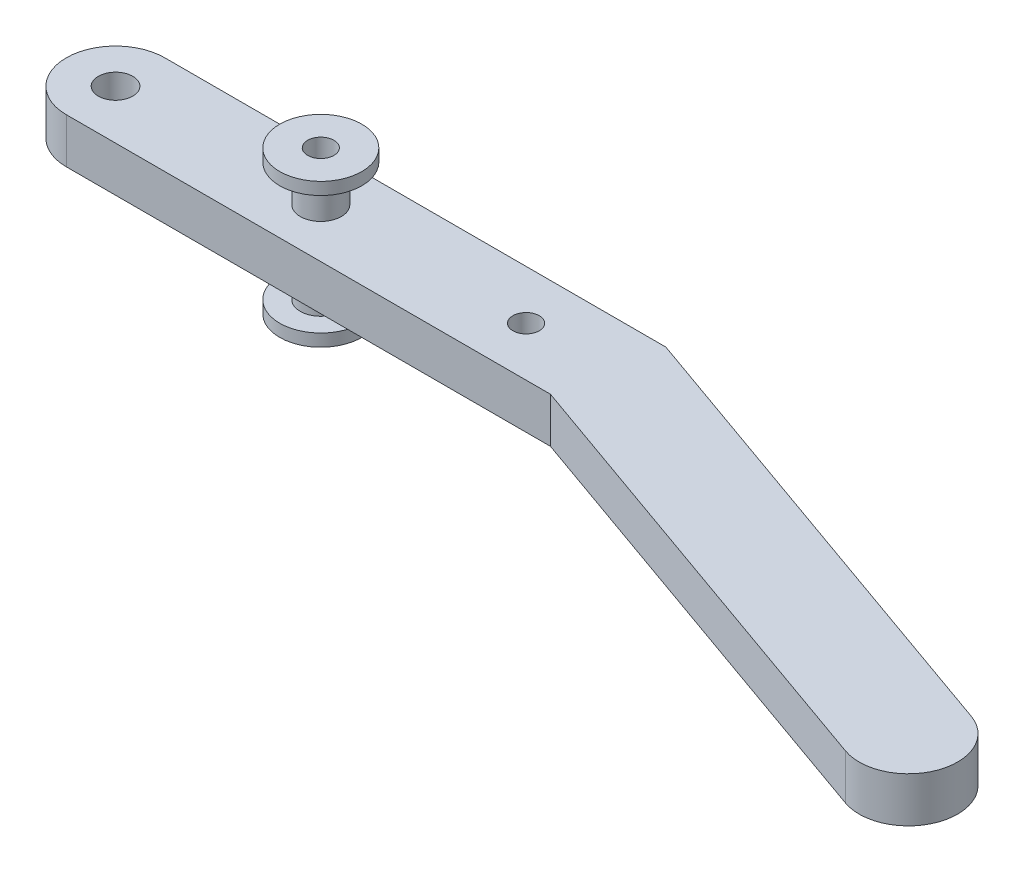
from build123d import *

# Parameters (mm, degrees)
SKETCH_1_R      = 2.1
SKETCH_1_R_2    = 1.6
EXTRUDE_1_DEPTH = 5.5
SKETCH_2_R      = 2.5
SKETCH_2_R_2    = 1.6
EXTRUDE_2_DEPTH = 4.5
SKETCH_3_R      = 5
SKETCH_3_R_2    = 1.6
EXTRUDE_4_DEPTH = 1.5


with BuildPart() as part:
    # ｽｹｯﾁ1 → ﾎﾞｽ - 押し出し1 (new body)
    with BuildSketch(Plane(origin=(0, 0, 0), x_dir=(1, 0, 0), z_dir=(0, 1, 0))):
        with BuildLine():
            Line((0, 6), (61.029437252, 6))
            Line((61.029437252, 6), (118.568542495, -14.343145751))
            ThreePointArc((118.568542495, -14.343145751), (122.225396744, -22), (114.568542495, -25.656854249))
            Line((114.568542495, -25.656854249), (58.970562748, -6))
            Line((58.970562748, -6), (0, -6))
            ThreePointArc((0, -6), (-6, 0), (0, 6))
        make_face()
        with Locations(Location((0, 0, 0), (0, 0, 270))):
            Circle(SKETCH_1_R, mode=Mode.SUBTRACT)
        with Locations(Location((50, 0, 0), (0, 0, 270))):
            Circle(SKETCH_1_R_2, mode=Mode.SUBTRACT)
        with Locations(Location((25, 0, 0), (0, 0, 270))):
            Circle(SKETCH_1_R_2, mode=Mode.SUBTRACT)
    extrude(amount=EXTRUDE_1_DEPTH)


with BuildPart() as body_2:
    # ｽｹｯﾁ2 → ﾎﾞｽ - 押し出し2 (new body)
    with BuildSketch(Plane(origin=(0, 5.5, 0), x_dir=(1, 0, 0), z_dir=(0, 1, 0))):
        with Locations(Location((25, 0, 0), (0, 0, 270))):
            Circle(SKETCH_2_R)
        with Locations(Location((25, 0, 0), (0, 0, 270))):
            Circle(SKETCH_2_R_2, mode=Mode.SUBTRACT)
    extrude(amount=EXTRUDE_2_DEPTH)

    # ｽｹｯﾁ3 → ﾎﾞｽ - 押し出し4 (add)
    with BuildSketch(Plane(origin=(0, 10, 0), x_dir=(1, 0, 0), z_dir=(0, 1, 0))):
        with Locations(Location((25, 0, 0), (0, 0, 270))):
            Circle(SKETCH_3_R)
        with Locations(Location((25, 0, 0), (0, 0, 270))):
            Circle(SKETCH_3_R_2, mode=Mode.SUBTRACT)
    extrude(amount=EXTRUDE_4_DEPTH)


with BuildPart() as body_3:
    # ﾐﾗｰ1: mirrored copy
    add(body_2.part.mirror(Plane.ZX.offset(2.75)))


solid = Compound([part.part, body_2.part, body_3.part])
